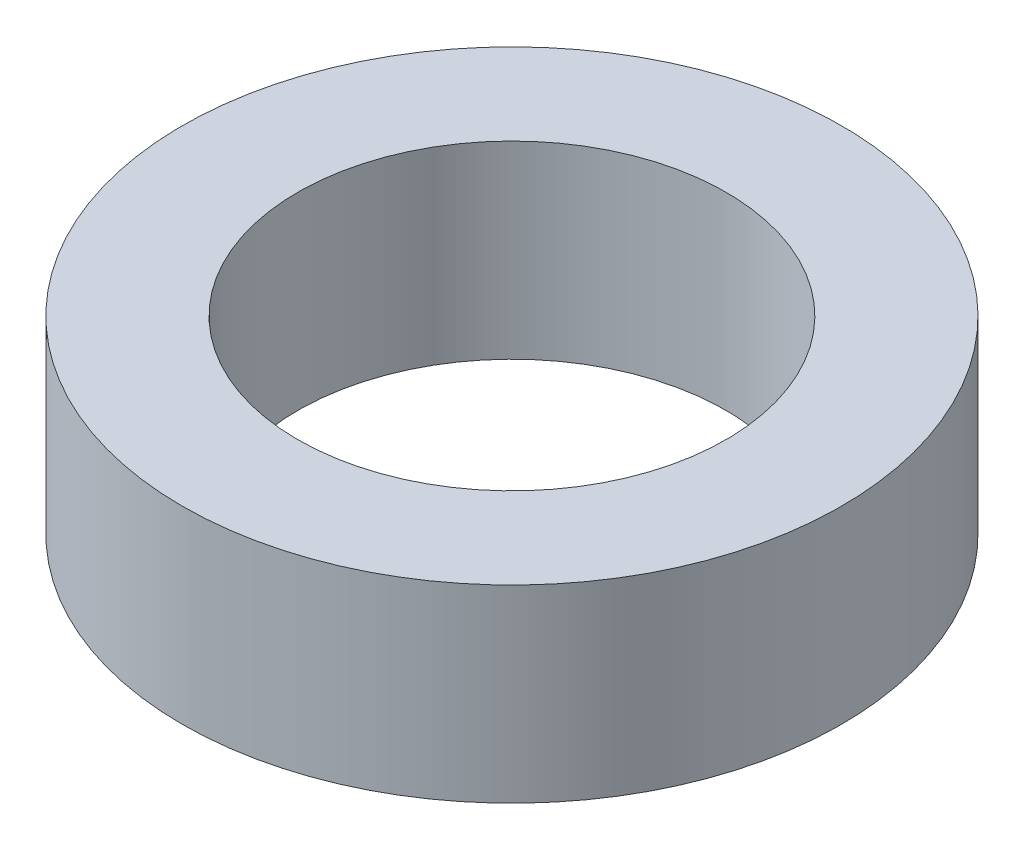
from build123d import *

# Parameters (mm, degrees)
SKETCH1_R              = 3
BOSS_EXTRUDE1_DEPTH    = 1.72
M3_5_CLEARANCE_HOLE1_D = 3.9


with BuildPart() as part:
    # Sketch1 → Boss-Extrude1 (new body)
    with BuildSketch(Plane(origin=(0, 0, 0), x_dir=(1, 0, 0), z_dir=(0, 1, 0))):
        with Locations(Location((0, 0, 0), (0, 0, 270))):
            Circle(SKETCH1_R)
    extrude(amount=BOSS_EXTRUDE1_DEPTH)

    # M3.5 Clearance Hole1 (through all)
    with Locations(Plane(origin=(0, 1.72, 0), x_dir=(1, 0, 0), z_dir=(0, 1, 0))):
        with Locations((0, 0)):
            Hole(M3_5_CLEARANCE_HOLE1_D / 2)


solid = part.part
